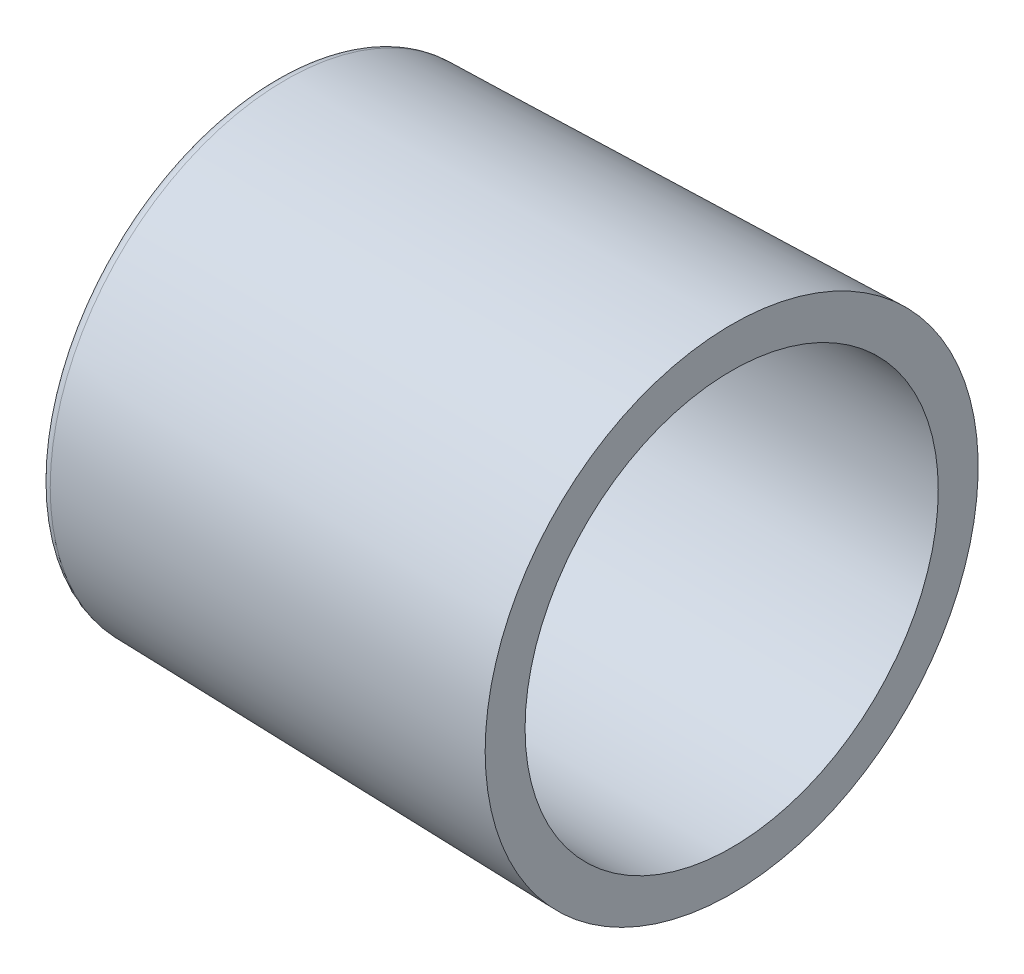
from build123d import *

# Parameters (mm, degrees)
BOSS_EXTRUDE1_START = -21
SKETCH2_R           = 10.322343774
SKETCH2_R_2         = 9.5
BOSS_EXTRUDE1_DEPTH = 21
FILLET1_R           = 0.5


with BuildPart() as part:
    # Sketch1 → Revolve1 (revolve)
    with BuildSketch(Plane.XY, mode=Mode.PRIVATE) as revolve1_sk:
        with BuildLine():
            Line((6, 11.335), (-14.512496096, 10.822187598))
            ThreePointArc((-14.512496096, 10.822187598), (-14.857944163, 10.671451174), (-15, 10.322343774))
            Line((-15, 10.322343774), (6, 10.322343774))
            Line((6, 10.322343774), (6, 11.335))
        make_face()
    revolve(revolve1_sk.sketch.rotate(Axis((-15.624243475, 0, 0), (1, 0, 0)), 90), axis=Axis((-15.624243475, 0, 0), (1, 0, 0)))

    # Sketch2 → Boss-Extrude1 (add)
    with BuildSketch(Plane(origin=(6, 0, 0), x_dir=(0, 0, -1), z_dir=(1, 0, 0)).offset(BOSS_EXTRUDE1_START)):
        Circle(SKETCH2_R)
        Circle(SKETCH2_R_2, mode=Mode.SUBTRACT)
    extrude(amount=BOSS_EXTRUDE1_DEPTH)

    # Fillet1
    fillet1_edges = [part.edges().sort_by_distance(p)[0] for p in [
        (-15, 0, 9.5),
    ]]
    fillet(fillet1_edges, radius=FILLET1_R)


solid = part.part
